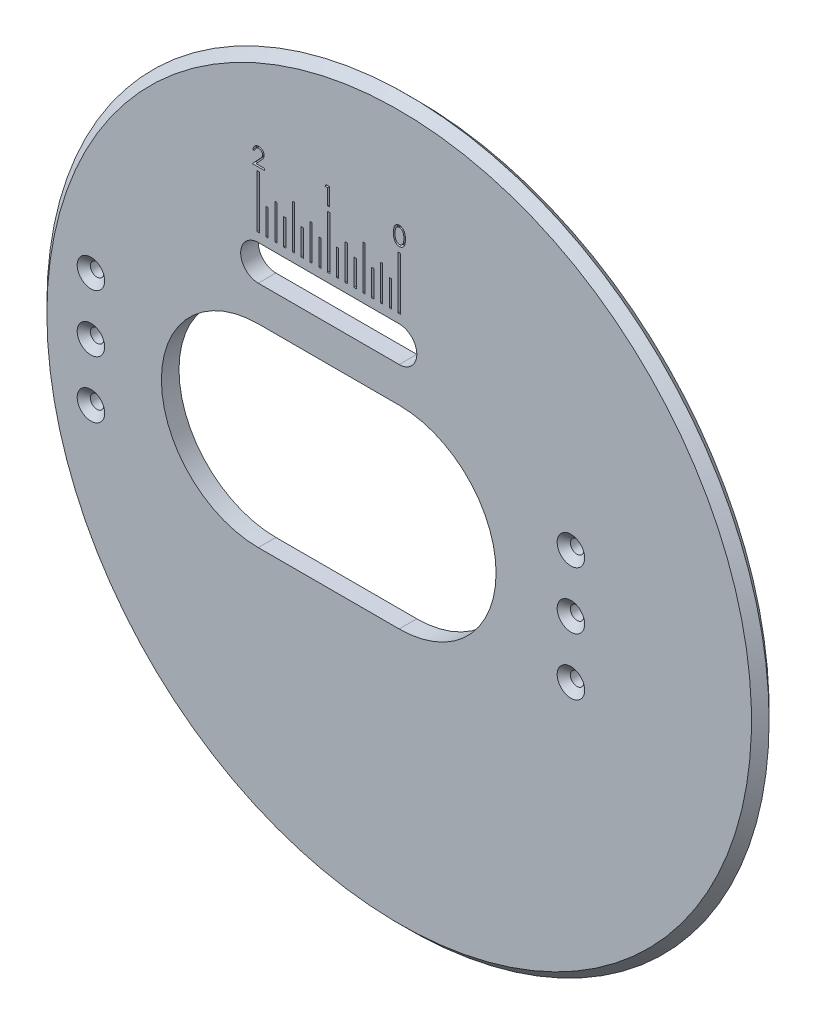
from build123d import *

# Parameters (mm, degrees)
SKETCH1_R           = 152.4
BOSS_EXTRUDE1_DEPTH = 6.35
SKETCH2_R           = 2.413
CUT_EXTRUDE1_DEPTH  = 10.16
SKETCH4_R           = 2.413
CUT_EXTRUDE2_DEPTH  = 7.62
CHAMFER1_SIZE       = 2.54
CHAMFER1_SIZE2      = 2.207988314
SKETCH6_R           = 152.4
SKETCH6_R_2         = 127
CUT_EXTRUDE3_DEPTH  = 7.62
CUT_EXTRUDE4_DEPTH  = 7.62
SKETCH9_W           = 0.79375
SKETCH9_H           = 19.05
SKETCH9_H_2         = 15.875
SKETCH9_H_3         = 12.7
SKETCH9_H_4         = 9.525
CUT_EXTRUDE5_DEPTH  = 1.27
CUT_EXTRUDE6_DEPTH  = 1.27
CUT_EXTRUDE7_DEPTH  = 1.27
CUT_EXTRUDE8_DEPTH  = 1.27


with BuildPart() as part:
    # Sketch1 → Boss-Extrude1 (new body)
    with BuildSketch(Plane.XY):
        Circle(SKETCH1_R)
        with BuildLine():
            Line((-1.61e-07, -34.925), (-50.8, -34.925))
            ThreePointArc((-50.8, -34.925), (-85.725, 0), (-50.8, 34.925))
            Line((-50.8, 34.925), (-5e-08, 34.925))
            ThreePointArc((-5e-08, 34.925), (34.925, -5.6e-08), (-1.61e-07, -34.925))
        make_face(mode=Mode.SUBTRACT)
    extrude(amount=BOSS_EXTRUDE1_DEPTH)

    # Sketch2 → Cut-Extrude1 (cut)
    with BuildSketch(Plane(origin=(0, 0, 0), x_dir=(-1, 0, 0), z_dir=(0, 0, -1))):
        with Locations((111.125, 20.6375)):
            Circle(SKETCH2_R)
        with Locations((111.125, 0)):
            Circle(SKETCH2_R)
        with Locations((111.125, -20.6375)):
            Circle(SKETCH2_R)
    extrude(amount=-CUT_EXTRUDE1_DEPTH, mode=Mode.SUBTRACT)

    # Sketch4 → Cut-Extrude2 (cut)
    with BuildSketch(Plane.XY.offset(6.35)):
        with Locations((61.8998, 20.6375)):
            Circle(SKETCH4_R)
        with Locations((61.8998, 0)):
            Circle(SKETCH4_R)
        with Locations((61.8998, -20.6375)):
            Circle(SKETCH4_R)
    extrude(amount=-CUT_EXTRUDE2_DEPTH, mode=Mode.SUBTRACT)

    # Chamfer1
    chamfer1_edges = [part.edges().sort_by_distance(p)[0] for p in [
        (59.4868, 20.6375, 6.35),
        (59.4868, 0, 6.35),
        (59.4868, -20.6375, 6.35),
        (-108.712, 20.6375, 6.35),
        (-108.712, 0, 6.35),
        (-108.712, -20.6375, 6.35),
    ]]
    chamfer1_side = [part.faces().sort_by_distance(p)[0] for p in [
        (-148.089477062, 0, 6.35),
    ]]
    chamfer(chamfer1_edges, length=CHAMFER1_SIZE, length2=CHAMFER1_SIZE2, reference=chamfer1_side[0])

    # Sketch6 → Cut-Extrude3 (cut)
    with BuildSketch(Plane(origin=(0, 0, 0), x_dir=(-1, 0, 0), z_dir=(0, 0, -1))):
        Circle(SKETCH6_R)
        Circle(SKETCH6_R_2, mode=Mode.SUBTRACT)
    extrude(amount=-CUT_EXTRUDE3_DEPTH, mode=Mode.SUBTRACT)

    # Sketch5 → Revolve1 (revolve)
    with BuildSketch(Plane(origin=(0, 0, 0), x_dir=(1, 0, 0), z_dir=(0, 1, 0))):
        Polygon((-127, -6.35), (-127, 0), (-130.175, -3.175), align=None)
    revolve(axis=Axis((0, 0, 0), (0, 0, 1)))

    # Sketch8 → Cut-Extrude4 (cut)
    with BuildSketch(Plane.XY.offset(6.35)):
        with BuildLine():
            Line((0, 60.325), (-50.8, 60.325))
            ThreePointArc((-50.8, 60.325), (-57.15, 53.975), (-50.8, 47.625))
            Line((-50.8, 47.625), (0, 47.625))
            ThreePointArc((0, 47.625), (6.35, 53.975), (0, 60.325))
        make_face()
    extrude(amount=-CUT_EXTRUDE4_DEPTH, mode=Mode.SUBTRACT)

    # Sketch9 → Cut-Extrude5 (cut)
    with BuildSketch(Plane.XY.offset(6.35)):
        with Locations((0, 73.025)):
            Rectangle(SKETCH9_W, SKETCH9_H)
        with Locations((-50.8, 73.025)):
            Rectangle(SKETCH9_W, SKETCH9_H)
        with Locations((-25.4, 73.025)):
            Rectangle(SKETCH9_W, SKETCH9_H)
        with Locations((-38.1, 71.4375)):
            Rectangle(SKETCH9_W, SKETCH9_H_2)
        with Locations((-12.7, 71.4375)):
            Rectangle(SKETCH9_W, SKETCH9_H_2)
        with Locations((-44.45, 69.85)):
            Rectangle(SKETCH9_W, SKETCH9_H_3)
        with Locations((-31.75, 69.85)):
            Rectangle(SKETCH9_W, SKETCH9_H_3)
        with Locations((-19.05, 69.85)):
            Rectangle(SKETCH9_W, SKETCH9_H_3)
        with Locations((-6.35, 69.85)):
            Rectangle(SKETCH9_W, SKETCH9_H_3)
        with Locations((-47.625, 68.2625)):
            Rectangle(SKETCH9_W, SKETCH9_H_4)
        with Locations((-41.275, 68.2625)):
            Rectangle(SKETCH9_W, SKETCH9_H_4)
        with Locations((-34.925, 68.2625)):
            Rectangle(SKETCH9_W, SKETCH9_H_4)
        with Locations((-28.575, 68.2625)):
            Rectangle(SKETCH9_W, SKETCH9_H_4)
        with Locations((-22.225, 68.2625)):
            Rectangle(SKETCH9_W, SKETCH9_H_4)
        with Locations((-15.875, 68.2625)):
            Rectangle(SKETCH9_W, SKETCH9_H_4)
        with Locations((-9.525, 68.2625)):
            Rectangle(SKETCH9_W, SKETCH9_H_4)
        with Locations((-3.175, 68.2625)):
            Rectangle(SKETCH9_W, SKETCH9_H_4)
    extrude(amount=-CUT_EXTRUDE5_DEPTH, mode=Mode.SUBTRACT)

    # Sketch10 → Cut-Extrude6 (cut)
    with BuildSketch(Plane.XY.offset(6.35)):
        with BuildLine():
            add(Edge.make_bspline(
                [(-2.06261193, 87.805530597), (-2.062016812, 87.907307287), (-2.060860785, 88.105009972), (-2.048000364, 88.39309068), (-2.026636529, 88.663347204), (-1.997358724, 88.915792481), (-1.961729817, 89.150491683), (-1.914167434, 89.366817599), (-1.860078492, 89.565771457), (-1.797390483, 89.748002031), (-1.726655495, 89.915964435), (-1.649667622, 90.072764443), (-1.563371495, 90.218164806), (-1.472699096, 90.354486225), (-1.373980051, 90.479497215), (-1.270023674, 90.594963188), (-1.156772556, 90.69821555), (-1.038076527, 90.792279555), (-0.912860941, 90.874737883), (-0.784694961, 90.947368708), (-0.652696412, 91.009417039), (-0.516504909, 91.058203973), (-0.377344554, 91.098500795), (-0.234728876, 91.126057885), (-0.088422401, 91.143396848), (0.010331773, 91.145054502), (0.060414913, 91.145895181)],
                knots=[0, 0, 0, 0, 1.646270934, 3.197905019, 4.663502075, 6.030701355, 7.308322542, 8.50163776, 9.611534131, 10.641858119, 11.616356847, 12.558055219, 13.465016945, 14.349605745, 15.204443733, 16.039544428, 16.859896111, 17.680448484, 18.487036065, 19.28249412, 20.06191084, 20.843045899, 21.620316918, 22.403196591, 23.190181807, 24, 24, 24, 24], degree=3))
            add(Edge.make_bspline(
                [(0.060414913, 91.145895181), (0.110916424, 91.145010145), (0.21134804, 91.143250086), (0.359829863, 91.126333791), (0.504881429, 91.098264753), (0.645884337, 91.058493842), (0.783996813, 91.009153114), (0.918138581, 90.947309345), (1.049142858, 90.875320543), (1.174927808, 90.790731508), (1.296874324, 90.696420807), (1.411987057, 90.589808536), (1.520276485, 90.471971189), (1.623101681, 90.344169521), (1.717545408, 90.203952296), (1.807485778, 90.053758268), (1.887989329, 89.890960842), (1.965522239, 89.718276279), (2.032445772, 89.530926498), (2.092800246, 89.329967575), (2.141566375, 89.113025836), (2.182186912, 88.881239505), (2.213655508, 88.633757357), (2.236574731, 88.371109899), (2.248681613, 88.093124333), (2.250961628, 87.903063664), (2.252131659, 87.805530597)],
                knots=[0, 0, 0, 0, 0.810914788, 1.612654377, 2.396697861, 3.181598691, 3.963628158, 4.749916497, 5.551656086, 6.361998678, 7.18212741, 8.025565596, 8.878627764, 9.750805457, 10.657531673, 11.591944965, 12.560506719, 13.57287815, 14.630710178, 15.753379473, 16.941251878, 18.199788006, 19.531962791, 20.947069417, 22.433333509, 24, 24, 24, 24], degree=3))
            add(Edge.make_bspline(
                [(2.252131659, 87.805530597), (2.250949499, 87.708422936), (2.248646107, 87.519212618), (2.236710454, 87.242477848), (2.213199794, 86.981224255), (2.183790244, 86.734825273), (2.143057782, 86.504306451), (2.092974124, 86.288870094), (2.037365681, 86.08758585), (1.968722554, 85.902102692), (1.893591694, 85.729833137), (1.811848695, 85.568965597), (1.72427344, 85.41807818), (1.628862431, 85.278378639), (1.527165524, 85.148877361), (1.417006107, 85.031860246), (1.301489474, 84.924507741), (1.179184091, 84.828982646), (1.05143742, 84.745371643), (0.920883094, 84.670597943), (0.78520467, 84.610304339), (0.647476885, 84.558533622), (0.505729706, 84.518981373), (0.360139826, 84.491633093), (0.211447798, 84.472452739), (0.11093353, 84.470989554), (0.060414913, 84.470254155)],
                knots=[0, 0, 0, 0, 1.561518951, 3.042555995, 4.452378317, 5.7783523, 7.031515105, 8.214008947, 9.334062868, 10.386615937, 11.391082383, 12.354592575, 13.286541444, 14.194233754, 15.072674879, 15.931287219, 16.775624067, 17.606195743, 18.42308326, 19.229000347, 20.022332153, 20.807536673, 21.593273796, 22.3848459, 23.188221202, 24, 24, 24, 24], degree=3))
            add(Edge.make_bspline(
                [(0.060414913, 84.470254155), (0.010333163, 84.471100257), (-0.088418272, 84.472768605), (-0.234744815, 84.490029232), (-0.376771534, 84.517779645), (-0.515199274, 84.556635484), (-0.650738237, 84.604196687), (-0.7815415, 84.666161228), (-0.90906344, 84.737524467), (-1.032963835, 84.81879616), (-1.15091447, 84.911908357), (-1.263579082, 85.014894995), (-1.368127331, 85.130326041), (-1.465434904, 85.256378844), (-1.557916464, 85.391893727), (-1.642987185, 85.538720918), (-1.721674306, 85.696278225), (-1.793598924, 85.865583578), (-1.857368642, 86.049107518), (-1.913698056, 86.248949599), (-1.958173741, 86.466873682), (-1.996242818, 86.701129477), (-2.026948484, 86.952723607), (-2.047911331, 87.221792662), (-2.060867717, 87.50816897), (-2.062019916, 87.704601275), (-2.06261193, 87.805530597)],
                knots=[0, 0, 0, 0, 0.810891512, 1.598919785, 2.382837074, 3.152667961, 3.926044502, 4.706494248, 5.493654104, 6.291793342, 7.103789334, 7.925228297, 8.761435821, 9.622817696, 10.50288917, 11.416980706, 12.369136599, 13.353924996, 14.394355917, 15.514179734, 16.714354668, 17.994756427, 19.357759367, 20.818452758, 22.365282078, 24, 24, 24, 24], degree=3))
        make_face()
        with BuildLine():
            add(Edge.make_bspline(
                [(-1.492740136, 87.808074668), (-1.492523424, 87.723259172), (-1.492102831, 87.558648947), (-1.481115153, 87.319447603), (-1.466146874, 87.096344292), (-1.446840521, 86.889055733), (-1.418169457, 86.698283567), (-1.386044285, 86.522715714), (-1.346949894, 86.363281298), (-1.300694647, 86.21888627), (-1.248009429, 86.087080103), (-1.190485933, 85.964432184), (-1.12869005, 85.84949367), (-1.05953102, 85.743296981), (-0.984210834, 85.645495798), (-0.904430778, 85.554359087), (-0.817213375, 85.473084564), (-0.696556585, 85.375608699), (-0.537268696, 85.274881127), (-0.336571584, 85.187167507), (-0.130344537, 85.132045051), (0.009629874, 85.125035093), (0.079495441, 85.121536206)],
                knots=[0, 0, 0, 0, 1.459021318, 2.831673884, 4.118529203, 5.306027144, 6.411944654, 7.436330062, 8.375795394, 9.233974572, 10.042671642, 10.816086306, 11.563610507, 12.285937304, 12.993564865, 13.685989202, 14.367179055, 15.041617293, 16.353048772, 17.594441528, 18.799311195, 20, 20, 20, 20], degree=3))
            add(Edge.make_bspline(
                [(0.079495441, 85.121536206), (0.149812931, 85.124435037), (0.290302732, 85.130226714), (0.49555976, 85.186104423), (0.69482325, 85.270413445), (0.850982342, 85.370103919), (0.969786385, 85.46504246), (1.05490721, 85.545986179), (1.133034069, 85.636620395), (1.207133262, 85.734409118), (1.275094728, 85.841220625), (1.336894992, 85.956541297), (1.393289066, 86.080691377), (1.425418335, 86.167359332), (1.441845201, 86.211670421)],
                knots=[0, 0, 0, 0, 1.353760809, 2.704726607, 4.075137775, 5.516104923, 6.260822281, 7.007110065, 7.778089737, 8.566572457, 9.372053459, 10.217411131, 11.088608312, 12, 12, 12, 12], degree=3))
            add(Edge.make_bspline(
                [(1.441845201, 86.211670421), (1.460989123, 86.268330091), (1.499859493, 86.383373521), (1.549955141, 86.56183329), (1.589407508, 86.74907259), (1.624901043, 86.943972444), (1.649127302, 87.147970188), (1.668626906, 87.360434627), (1.680112581, 87.581525956), (1.681536343, 87.731739726), (1.682259864, 87.808074668)],
                knots=[0, 0, 0, 0, 0.884706709, 1.796334032, 2.740027952, 3.714592787, 4.726048262, 5.777819803, 6.87074269, 8, 8, 8, 8], degree=3))
            add(Edge.make_bspline(
                [(1.682259864, 87.808074668), (1.681261664, 87.884397264), (1.67930897, 88.033700577), (1.671845021, 88.252354991), (1.652570822, 88.460032214), (1.631163849, 88.657626929), (1.599600319, 88.844045335), (1.565568298, 89.020848032), (1.519846099, 89.185844662), (1.471005936, 89.341618475), (1.415107075, 89.486399662), (1.353574243, 89.620863246), (1.287857624, 89.74565839), (1.216479559, 89.860442698), (1.140287391, 89.965730312), (1.057270123, 90.059410219), (0.970720761, 90.144385861), (0.849495295, 90.241382236), (0.690791941, 90.340282027), (0.493314838, 90.431297048), (0.287809526, 90.483563522), (0.148883402, 90.490932583), (0.079495441, 90.49461313)],
                knots=[0, 0, 0, 0, 1.31362396, 2.569729283, 3.763502607, 4.902122613, 5.988968491, 7.01645872, 7.998833611, 8.933434873, 9.825090667, 10.667526885, 11.477055099, 12.250526234, 12.991942729, 13.710640831, 14.402115721, 15.076753259, 16.378508321, 17.609869233, 18.806226677, 20, 20, 20, 20], degree=3))
            add(Edge.make_bspline(
                [(0.079495441, 90.49461313), (0.009263367, 90.490927505), (-0.131328727, 90.483549541), (-0.338970017, 90.431491781), (-0.538005055, 90.340753972), (-0.696288737, 90.241054667), (-0.81759875, 90.146098017), (-0.903020208, 90.063754021), (-0.983113977, 89.973681531), (-1.056896805, 89.874980914), (-1.126001647, 89.768908034), (-1.189467199, 89.654628418), (-1.24664864, 89.531562942), (-1.299416298, 89.399815981), (-1.345812642, 89.25543341), (-1.384083118, 89.096195379), (-1.4194382, 88.921185947), (-1.44446676, 88.729380554), (-1.466716716, 88.522040076), (-1.481015733, 88.298379798), (-1.492139586, 88.05877728), (-1.492535943, 87.893315949), (-1.492740136, 87.808074668)],
                knots=[0, 0, 0, 0, 1.207732386, 2.417664972, 3.655092373, 4.956220595, 5.625982001, 6.301752483, 6.994047911, 7.697131622, 8.419323945, 9.170223765, 9.943494443, 10.752040957, 11.610060368, 12.549350801, 13.567764191, 14.679664412, 15.874934091, 17.154273443, 18.533957287, 20, 20, 20, 20], degree=3))
        make_face(mode=Mode.SUBTRACT)
    extrude(amount=-CUT_EXTRUDE6_DEPTH, mode=Mode.SUBTRACT)

    # Sketch11 → Cut-Extrude7 (cut)
    with BuildSketch(Plane.XY.offset(6.35)):
        Polygon((-26.366290416, 90.604942795), (-25.192201874, 90.604942795), (-25.192201874, 84.254942795), (-25.762073669, 84.254942795), (-25.762073669, 89.953660744), (-26.738996746, 89.953660744), align=None)
    extrude(amount=-CUT_EXTRUDE7_DEPTH, mode=Mode.SUBTRACT)

    # Sketch12 → Cut-Extrude8 (cut)
    with BuildSketch(Plane.XY.offset(6.35)):
        with BuildLine():
            Line((-52.117711852, 88.3072373), (-52.687583647, 88.3072373))
            add(Edge.make_bspline(
                [(-52.687583647, 88.3072373), (-52.683869527, 88.382840196), (-52.676575093, 88.531322273), (-52.642415197, 88.747809931), (-52.593536748, 88.954737923), (-52.524427967, 89.150444767), (-52.438600863, 89.336660889), (-52.335676385, 89.512646632), (-52.213767542, 89.677730646), (-52.075506753, 89.830382547), (-51.925340794, 89.970422854), (-51.763314303, 90.091354509), (-51.593052611, 90.193530855), (-51.415072273, 90.27894968), (-51.227365251, 90.343066257), (-51.031634923, 90.390639804), (-50.827021347, 90.419262602), (-50.687611592, 90.422339242), (-50.61671025, 90.423903967)],
                knots=[0, 0, 0, 0, 1.10065271, 2.161652631, 3.183658789, 4.190468796, 5.17591951, 6.163126047, 7.15150782, 8.156236427, 9.156009102, 10.134482811, 11.092018607, 12.041330605, 13.001268258, 13.972401359, 14.968799086, 16, 16, 16, 16], degree=3))
            add(Edge.make_bspline(
                [(-50.61671025, 90.423903967), (-50.547081458, 90.42227391), (-50.41026337, 90.419070907), (-50.21057943, 90.391564468), (-50.020483481, 90.34848318), (-49.840347105, 90.288039496), (-49.67160753, 90.206787749), (-49.512997149, 90.109183644), (-49.362627678, 89.996299092), (-49.227269657, 89.863395745), (-49.102976427, 89.721514276), (-48.99574805, 89.570043365), (-48.903921311, 89.413598804), (-48.827380806, 89.250987638), (-48.771036096, 89.080678773), (-48.72825849, 88.905151705), (-48.704078754, 88.722589547), (-48.700367772, 88.599024797), (-48.698481083, 88.536203646)],
                knots=[0, 0, 0, 0, 1.111607364, 2.184268762, 3.212621178, 4.221274766, 5.211760367, 6.196651075, 7.1921475, 8.207485113, 9.220403448, 10.201281604, 11.166441695, 12.114753415, 13.065576456, 14.026450734, 14.996634279, 16, 16, 16, 16], degree=3))
            add(Edge.make_bspline(
                [(-48.698481083, 88.536203646), (-48.701553146, 88.447761146), (-48.707643361, 88.272428187), (-48.759739444, 88.01477265), (-48.841103828, 87.765138876), (-48.939070461, 87.56422977), (-49.037899038, 87.402334718), (-49.126957802, 87.269041496), (-49.231215388, 87.125521575), (-49.352189234, 86.972255548), (-49.487376874, 86.808042906), (-49.638002799, 86.632982849), (-49.805141116, 86.448884066), (-49.92245011, 86.323143904), (-49.983236692, 86.257988502)],
                knots=[0, 0, 0, 0, 1.184426356, 2.348067706, 3.509069118, 4.696110526, 5.333549288, 6.050745305, 6.844228056, 7.710549037, 8.667450064, 9.695053472, 10.805634456, 12, 12, 12, 12], degree=3))
            Line((-49.983236692, 86.257988502), (-51.572008727, 84.562365505))
            Line((-51.572008727, 84.562365505), (-48.617070827, 84.562365505))
            Line((-48.617070827, 84.562365505), (-48.617070827, 83.911083454))
            Line((-48.617070827, 83.911083454), (-52.931814416, 83.911083454))
            Line((-52.931814416, 83.911083454), (-50.46915416, 86.539108293))
            add(Edge.make_bspline(
                [(-50.46915416, 86.539108293), (-50.409195851, 86.601698078), (-50.29402821, 86.721920245), (-50.131136964, 86.897439616), (-49.984834799, 87.060270925), (-49.854174673, 87.210106521), (-49.741991027, 87.349138079), (-49.642437121, 87.472862756), (-49.562670977, 87.586717258), (-49.476101616, 87.718689515), (-49.39225625, 87.879820433), (-49.32020669, 88.076731555), (-49.276274036, 88.279436714), (-49.271003835, 88.416418981), (-49.268352878, 88.485322236)],
                knots=[0, 0, 0, 0, 1.329631726, 2.553950428, 3.673215718, 4.687767853, 5.603093632, 6.413772471, 7.123043292, 7.734684054, 8.834405432, 9.900288307, 10.943827018, 12, 12, 12, 12], degree=3))
            add(Edge.make_bspline(
                [(-49.268352878, 88.485322236), (-49.269506296, 88.528649916), (-49.271779462, 88.614040453), (-49.291841284, 88.739236616), (-49.322158917, 88.860004206), (-49.365602457, 88.976714701), (-49.422946114, 89.08819467), (-49.492747817, 89.194579812), (-49.573284075, 89.297429792), (-49.666449949, 89.393865062), (-49.768796564, 89.482186677), (-49.87691756, 89.560426089), (-49.991308463, 89.625811333), (-50.11148697, 89.679411678), (-50.237118036, 89.721458441), (-50.368444645, 89.750593292), (-50.505103932, 89.768885799), (-50.598418988, 89.771360797), (-50.645967061, 89.772621915)],
                knots=[0, 0, 0, 0, 0.991446411, 1.95395049, 2.89581595, 3.838931463, 4.798493298, 5.75982156, 6.748411868, 7.785213223, 8.824556874, 9.840280684, 10.836137867, 11.835679398, 12.848801643, 13.863922112, 14.911575587, 16, 16, 16, 16], degree=3))
            add(Edge.make_bspline(
                [(-50.645967061, 89.772621915), (-50.695625571, 89.771324642), (-50.793146687, 89.768777013), (-50.936328362, 89.750955894), (-51.072918272, 89.720211298), (-51.20326001, 89.678162188), (-51.327574116, 89.624715964), (-51.445256025, 89.558146656), (-51.556041552, 89.47871089), (-51.660138959, 89.388648738), (-51.756049321, 89.288377518), (-51.840317224, 89.176599442), (-51.913948221, 89.055355417), (-51.978190688, 88.92497259), (-52.030361725, 88.784267875), (-52.070227298, 88.633740753), (-52.101772006, 88.474044818), (-52.112310322, 88.363763307), (-52.117711852, 88.3072373)],
                knots=[0, 0, 0, 0, 1.031018746, 2.02475058, 2.990194455, 3.934040569, 4.864654155, 5.795059489, 6.735614925, 7.690564532, 8.649604399, 9.611025574, 10.590972636, 11.591080095, 12.624614302, 13.701020113, 14.821632451, 16, 16, 16, 16], degree=3))
        make_face()
    extrude(amount=-CUT_EXTRUDE8_DEPTH, mode=Mode.SUBTRACT)


solid = part.part
